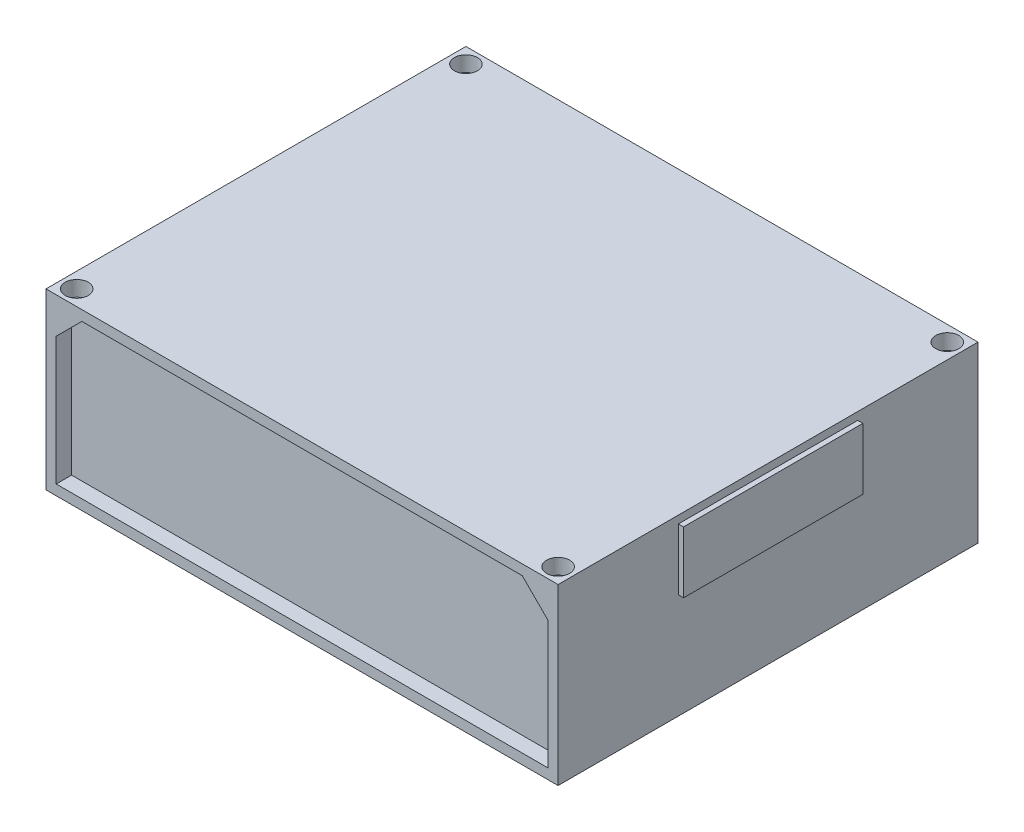
from build123d import *

# Parameters (mm, degrees)
SKETCH1_W                = 100
SKETCH1_H                = 82
BOSS_EXTRUDE1_DEPTH      = 34
SKETCH2_W                = 96
SKETCH2_H                = 30
CUT_EXTRUDE1_DEPTH       = 3
CHAMFER1_SIZE            = 5
CHAMFER1_OF_MIRROR4_SIZE = 5
SKETCH3_R                = 2.25
CUT_EXTRUDE2_DEPTH       = 3
SKETCH4_W                = 35
SKETCH4_H                = 12
BOSS_EXTRUDE2_DEPTH      = 1


with BuildPart() as part:
    # Sketch1 → Boss-Extrude1 (new body)
    with BuildSketch(Plane(origin=(0, 0, 0), x_dir=(1, 0, 0), z_dir=(0, 1, 0))):
        with Locations((50, 41)):
            Rectangle(SKETCH1_W, SKETCH1_H)
    extrude(amount=BOSS_EXTRUDE1_DEPTH)

    # Sketch2 → Cut-Extrude1 (cut)
    with BuildSketch(Plane.XY):
        with Locations((50, 17)):
            Rectangle(SKETCH2_W, SKETCH2_H)
    cut_extrude1 = extrude(amount=-CUT_EXTRUDE1_DEPTH, mode=Mode.SUBTRACT)

    # Chamfer1
    chamfer1_edges = [part.edges().sort_by_distance(p)[0] for p in [
        (2, 32, -1.5),
        (98, 32, -1.5),
    ]]
    chamfer(chamfer1_edges, length=CHAMFER1_SIZE)

    # Mirror4: Cut-Extrude1 across plane
    add(cut_extrude1.mirror(Plane.XY.offset(-41)), mode=Mode.SUBTRACT)

    # Chamfer1 of Mirror4
    chamfer1_of_mirror4_edges = [part.edges().sort_by_distance(p)[0] for p in [
        (2, 32, -80.5),
        (98, 32, -80.5),
    ]]
    chamfer(chamfer1_of_mirror4_edges, length=CHAMFER1_OF_MIRROR4_SIZE)

    # Sketch3 → Cut-Extrude2 (cut)
    with BuildSketch(Plane(origin=(0, 34, 0), x_dir=(1, 0, 0), z_dir=(0, 1, 0))):
        with Locations(Location((3, 79, 0), (0, 0, 270))):
            Circle(SKETCH3_R)
        with Locations(Location((3, 3, 0), (0, 0, 270))):
            Circle(SKETCH3_R)
        with Locations(Location((97, 3, 0), (0, 0, 270))):
            Circle(SKETCH3_R)
        with Locations(Location((97, 79, 0), (0, 0, 270))):
            Circle(SKETCH3_R)
    extrude(amount=-CUT_EXTRUDE2_DEPTH, mode=Mode.SUBTRACT)

    # Sketch4 → Boss-Extrude2 (add)
    with BuildSketch(Plane(origin=(100, 0, 0), x_dir=(0, 0, -1), z_dir=(1, 0, 0))):
        with Locations((41, 26.5)):
            Rectangle(SKETCH4_W, SKETCH4_H)
    extrude(amount=BOSS_EXTRUDE2_DEPTH)


solid = part.part
